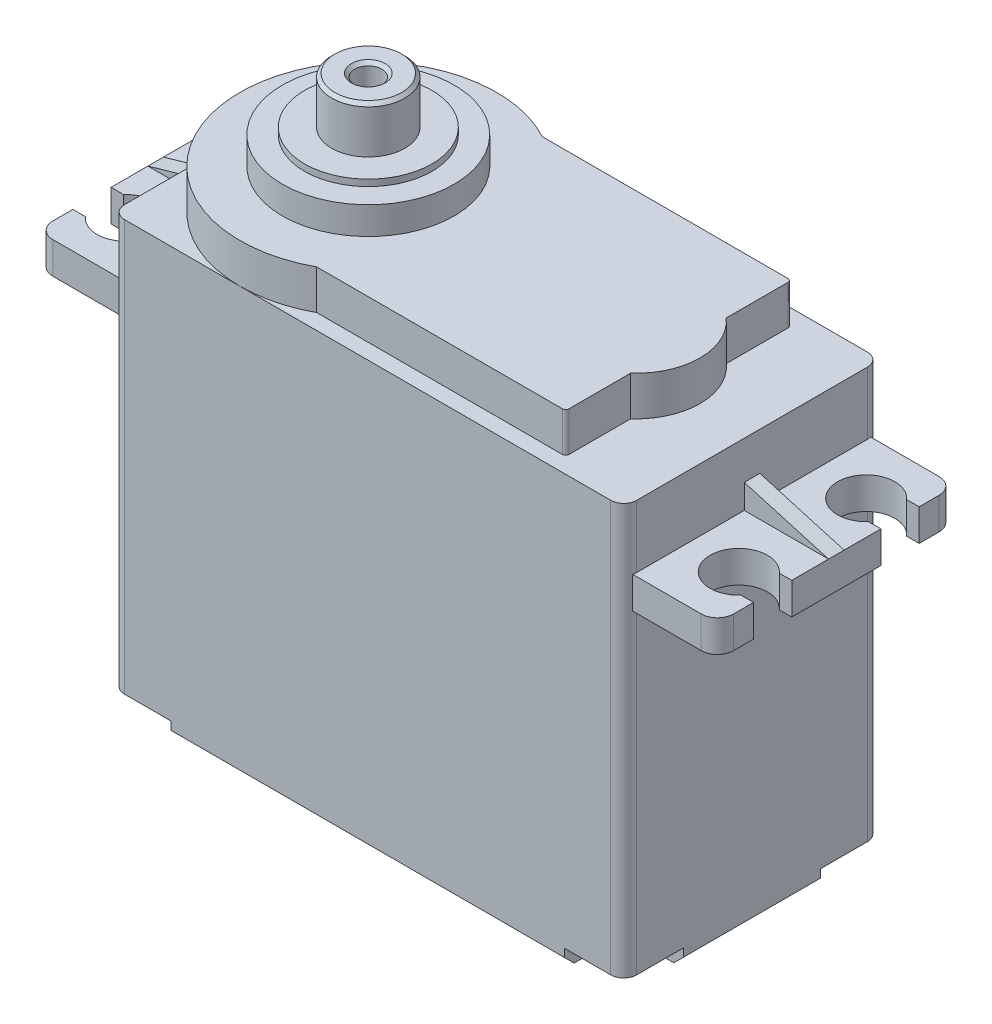
from build123d import *

# Parameters (mm, degrees)
BOSS_EXTRUDE1_DEPTH = 33.6042
CUT_EXTRUDE1_DEPTH  = 1.397
CHAMFER1_SIZE       = 0.762
SKETCH3_W           = 18.6436
SKETCH3_H           = 2.4892
BOSS_EXTRUDE2_DEPTH = 6.604
SKETCH4_W           = 18.6436
SKETCH4_H           = 2.4892
BOSS_EXTRUDE3_DEPTH = 6.604
FILLET1_R           = 1.27
CUT_EXTRUDE2_DEPTH  = 3.048
SKETCH6_W           = 6.604
SKETCH6_H           = 1.2192
BOSS_EXTRUDE4_DEPTH = 1.905
CUT_EXTRUDE3_DEPTH  = 1.905
BOSS_EXTRUDE5_DEPTH = 3.0988
SKETCH9_R           = 6.731
BOSS_EXTRUDE6_DEPTH = 2.159
SKETCH10_R          = 4.9911
BOSS_EXTRUDE7_DEPTH = 0.508
SKETCH11_R          = 2.8702
BOSS_EXTRUDE8_DEPTH = 3.6576
SKETCH12_R          = 1.0668
CUT_EXTRUDE4_DEPTH  = 5.08
CHAMFER2_SIZE       = 0.254


with BuildPart() as part:
    # Sketch1 → Boss-Extrude1 (new body)
    with BuildSketch(Plane(origin=(0, 0, 0), x_dir=(1, 0, 0), z_dir=(0, 1, 0))):
        with BuildLine():
            Line((0, 9.0424), (0, -9.0424))
            ThreePointArc((0, -9.0424), (0.29757951, -9.76082049), (1.016, -10.0584))
            Line((1.016, -10.0584), (39.116, -10.0584))
            ThreePointArc((39.116, -10.0584), (39.83442049, -9.76082049), (40.132, -9.0424))
            Line((40.132, -9.0424), (40.132, 9.0424))
            ThreePointArc((40.132, 9.0424), (39.83442049, 9.76082049), (39.116, 10.0584))
            Line((39.116, 10.0584), (1.016, 10.0584))
            ThreePointArc((1.016, 10.0584), (0.29757951, 9.76082049), (0, 9.0424))
        make_face()
    extrude(amount=BOSS_EXTRUDE1_DEPTH)

    # Sketch2 → Cut-Extrude1 (cut)
    with BuildSketch(Plane.XZ):
        with BuildLine():
            Line((4.6482, 10.0584), (4.6482, 7.3533))
            ThreePointArc((4.6482, 7.3533), (4.067919955, 5.952380045), (2.667, 5.3721))
            Line((2.667, 5.3721), (0, 5.3721))
            Line((0, 5.3721), (0, 9.0424))
            ThreePointArc((0, 9.0424), (0.29757951, 9.76082049), (1.016, 10.0584))
            Line((1.016, 10.0584), (4.6482, 10.0584))
        make_face()
        with BuildLine():
            Line((35.4838, 10.0584), (35.4838, 7.3533))
            ThreePointArc((35.4838, 7.3533), (36.064080045, 5.952380045), (37.465, 5.3721))
            Line((37.465, 5.3721), (40.132, 5.3721))
            Line((40.132, 5.3721), (40.132, 9.0424))
            ThreePointArc((40.132, 9.0424), (39.83442049, 9.76082049), (39.116, 10.0584))
            Line((39.116, 10.0584), (35.4838, 10.0584))
        make_face()
        with BuildLine():
            Line((0, -5.3721), (2.667, -5.3721))
            ThreePointArc((2.667, -5.3721), (4.067919955, -5.952380045), (4.6482, -7.3533))
            Line((4.6482, -7.3533), (4.6482, -10.0584))
            Line((4.6482, -10.0584), (1.016, -10.0584))
            ThreePointArc((1.016, -10.0584), (0.29757951, -9.76082049), (0, -9.0424))
            Line((0, -9.0424), (0, -5.3721))
        make_face()
        with BuildLine():
            Line((37.465, -5.3721), (40.132, -5.3721))
            Line((40.132, -5.3721), (40.132, -9.0424))
            ThreePointArc((40.132, -9.0424), (39.83442049, -9.76082049), (39.116, -10.0584))
            Line((39.116, -10.0584), (35.4838, -10.0584))
            Line((35.4838, -10.0584), (35.4838, -7.3533))
            ThreePointArc((35.4838, -7.3533), (36.064080045, -5.952380045), (37.465, -5.3721))
        make_face()
    extrude(amount=-CUT_EXTRUDE1_DEPTH, mode=Mode.SUBTRACT)

    # Chamfer1
    chamfer1_edges = [part.edges().sort_by_distance(p)[0] for p in [
        (20.066, 0, 10.0584),
        (0, 0, 0),
        (40.132, 0, 0),
        (20.066, 0, -10.0584),
    ]]
    chamfer(chamfer1_edges, length=CHAMFER1_SIZE)

    # Sketch3 → Boss-Extrude2 (add, symmetric)
    with BuildSketch(Plane(origin=(40.132, 0, 0), x_dir=(0, 0, -1), z_dir=(1, 0, 0))):
        with Locations((0, 27.4574)):
            Rectangle(SKETCH3_W, SKETCH3_H)
    extrude(amount=BOSS_EXTRUDE2_DEPTH, both=True)

    # Sketch4 → Boss-Extrude3 (add, symmetric)
    with BuildSketch(Plane.ZY):
        with Locations((0, 27.4574)):
            Rectangle(SKETCH4_W, SKETCH4_H)
    extrude(amount=BOSS_EXTRUDE3_DEPTH, both=True)

    # Fillet1
    fillet1_edges = [part.edges().sort_by_distance(p)[0] for p in [
        (46.736, 27.4574, 9.3218),
        (46.736, 27.4574, -9.3218),
        (-6.604, 27.4574, -9.3218),
        (-6.604, 27.4574, 9.3218),
    ]]
    fillet(fillet1_edges, radius=FILLET1_R)

    # Sketch5 → Cut-Extrude2 (cut)
    with BuildSketch(Plane(origin=(0, 28.702, 0), x_dir=(1, 0, 0), z_dir=(0, 1, 0))):
        with BuildLine():
            Line((-6.604, 3.4925), (-5.625185736, 3.4925))
            ThreePointArc((-5.625185736, 3.4925), (-1.7018, 4.9911), (-5.625185736, 6.4897))
            Line((-5.625185736, 6.4897), (-6.604, 6.4897))
            Line((-6.604, 6.4897), (-6.604, 3.4925))
        make_face()
        with BuildLine():
            Line((-6.604, -6.4897), (-5.625185736, -6.4897))
            ThreePointArc((-5.625185736, -6.4897), (-1.7018, -4.9911), (-5.625185736, -3.4925))
            Line((-5.625185736, -3.4925), (-6.604, -3.4925))
            Line((-6.604, -3.4925), (-6.604, -6.4897))
        make_face()
        with BuildLine():
            Line((45.757185736, -6.4897), (46.736, -6.4897))
            Line((46.736, -6.4897), (46.736, -3.4925))
            Line((46.736, -3.4925), (45.757185736, -3.4925))
            ThreePointArc((45.757185736, -3.4925), (41.8338, -4.9911), (45.757185736, -6.4897))
        make_face()
        with BuildLine():
            Line((45.757185736, 3.4925), (46.736, 3.4925))
            Line((46.736, 3.4925), (46.736, 6.4897))
            Line((46.736, 6.4897), (45.757185736, 6.4897))
            ThreePointArc((45.757185736, 6.4897), (41.8338, 4.9911), (45.757185736, 3.4925))
        make_face()
    extrude(amount=-CUT_EXTRUDE2_DEPTH, mode=Mode.SUBTRACT)

    # Sketch6 → Boss-Extrude4 (add)
    with BuildSketch(Plane(origin=(0, 28.702, 0), x_dir=(1, 0, 0), z_dir=(0, 1, 0))):
        with Locations((-3.302, 0)):
            Rectangle(SKETCH6_W, SKETCH6_H)
        with Locations((43.434, 0)):
            Rectangle(SKETCH6_W, SKETCH6_H)
    extrude(amount=BOSS_EXTRUDE4_DEPTH)

    # Sketch7 → Cut-Extrude3 (cut)
    with BuildSketch(Plane.XY.offset(0.6096)):
        Polygon((40.132, 30.607), (46.736, 28.702), (46.736, 30.607), align=None)
        Polygon((0, 30.607), (-6.604, 28.702), (-6.604, 30.607), align=None)
    extrude(amount=-CUT_EXTRUDE3_DEPTH, mode=Mode.SUBTRACT)

    # Sketch8 → Boss-Extrude5 (add)
    with BuildSketch(Plane(origin=(0, 33.6042, 0), x_dir=(1, 0, 0), z_dir=(0, 1, 0))):
        with BuildLine():
            Line((14.8583952, -8.8392), (34.1122, -8.8392))
            ThreePointArc((34.1122, -8.8392), (34.291805122, -8.764805122), (34.3662, -8.5852))
            Line((34.3662, -8.5852), (34.3662, -3.741254719))
            ThreePointArc((34.3662, -3.741254719), (36.053651663, 0), (34.3662, 3.741254719))
            Line((34.3662, 3.741254719), (34.3662, 8.5852))
            ThreePointArc((34.3662, 8.5852), (34.291805122, 8.764805122), (34.1122, 8.8392))
            Line((34.1122, 8.8392), (14.8583952, 8.8392))
            ThreePointArc((14.8583952, 8.8392), (0, 0), (14.8583952, -8.8392))
        make_face()
    extrude(amount=BOSS_EXTRUDE5_DEPTH)

    # Sketch9 → Boss-Extrude6 (add)
    with BuildSketch(Plane(origin=(0, 36.703, 0), x_dir=(1, 0, 0), z_dir=(0, 1, 0))):
        with Locations(Location((10.0584, 0, 0), (0, 0, 270))):
            Circle(SKETCH9_R)
    extrude(amount=BOSS_EXTRUDE6_DEPTH)

    # Sketch10 → Boss-Extrude7 (add)
    with BuildSketch(Plane(origin=(0, 38.862, 0), x_dir=(1, 0, 0), z_dir=(0, 1, 0))):
        with Locations(Location((10.0584, 0, 0), (0, 0, 270))):
            Circle(SKETCH10_R)
    extrude(amount=BOSS_EXTRUDE7_DEPTH)

    # Sketch11 → Boss-Extrude8 (add)
    with BuildSketch(Plane(origin=(0, 39.37, 0), x_dir=(1, 0, 0), z_dir=(0, 1, 0))):
        with Locations(Location((10.0584, 0, 0), (0, 0, 270))):
            Circle(SKETCH11_R)
    extrude(amount=BOSS_EXTRUDE8_DEPTH)

    # Sketch12 → Cut-Extrude4 (cut)
    with BuildSketch(Plane(origin=(0, 43.0276, 0), x_dir=(1, 0, 0), z_dir=(0, 1, 0))):
        with Locations(Location((10.0584, 0, 0), (0, 0, 270))):
            Circle(SKETCH12_R)
    extrude(amount=-CUT_EXTRUDE4_DEPTH, mode=Mode.SUBTRACT)

    # Chamfer2
    chamfer2_edges = [part.edges().sort_by_distance(p)[0] for p in [
        (10.0584, 43.0276, -2.8702),
        (10.0584, 43.0276, -1.0668),
    ]]
    chamfer(chamfer2_edges, length=CHAMFER2_SIZE)


solid = part.part
